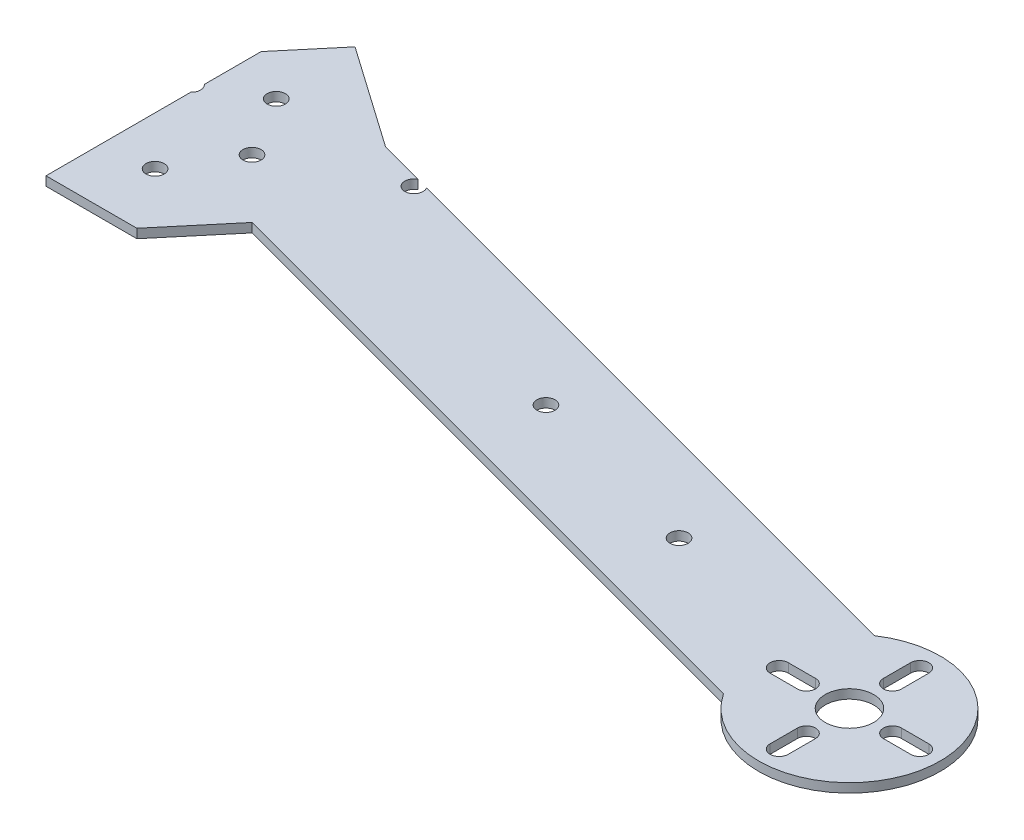
from build123d import *

# Parameters (mm, degrees)
SKETCH2_R           = 1.5
SKETCH2_R_2         = 4
BOSS_EXTRUDE1_DEPTH = 1.5
SKETCH6_R           = 1.5
CUT_EXTRUDE1_DEPTH  = 1.5
SKETCH7_R           = 1.5
CUT_EXTRUDE2_DEPTH  = 1.5


with BuildPart() as part:
    # Sketch2 → Boss-Extrude1 (new body)
    with BuildSketch(Plane(origin=(0, 0, 0), x_dir=(1, 0, 0), z_dir=(0, 1, 0))):
        with BuildLine():
            Line((0, -46.879161521), (0, -70.761127532))
            Line((0, -70.761127532), (15, -70.761127532))
            Line((15, -70.761127532), (23.677632731, -60.41952755))
            Line((23.677632731, -60.41952755), (129.929473623, -88.889622511))
            ThreePointArc((129.929473623, -88.889622511), (157.136079306, -83.55030532), (134.097880355, -68.124706791))
            Line((134.097880355, -68.124706791), (23.863280614, -38.592955603))
            Line((23.863280614, -38.592955603), (7.070663707, -26.834638658))
            Line((7.070663707, -26.834638658), (0, -35.261127532))
            Line((0, -35.261127532), (0, -44.643093543))
            ThreePointArc((0, -44.643093543), (0.5, -45.761127532), (0, -46.879161521))
        make_face()
        with Locations(Location((8, -40.761127532, 0), (0, 0, 90))):
            Circle(SKETCH2_R, mode=Mode.SUBTRACT)
        with Locations(Location((14, -50.761127532, 0), (0, 0, 90))):
            Circle(SKETCH2_R, mode=Mode.SUBTRACT)
        with Locations(Location((8, -60.761127532, 0), (0, 0, 90))):
            Circle(SKETCH2_R, mode=Mode.SUBTRACT)
        with Locations(Location((142.429473623, -80.598060535, 0), (0, 0, 90))):
            Circle(SKETCH2_R_2, mode=Mode.SUBTRACT)
        with BuildLine():
            Line((143.929473623, -73.498060535), (143.929473623, -68.998060535))
            ThreePointArc((143.929473623, -68.998060535), (142.429473623, -67.498060535), (140.929473623, -68.998060535))
            Line((140.929473623, -68.998060535), (140.929473623, -73.498060535))
            ThreePointArc((140.929473623, -73.498060535), (142.429473623, -74.998060535), (143.929473623, -73.498060535))
        make_face(mode=Mode.SUBTRACT)
        with BuildLine():
            Line((149.529473623, -82.098060535), (154.029473623, -82.098060535))
            ThreePointArc((154.029473623, -82.098060535), (155.529473623, -80.598060535), (154.029473623, -79.098060535))
            Line((154.029473623, -79.098060535), (149.529473623, -79.098060535))
            ThreePointArc((149.529473623, -79.098060535), (148.029473623, -80.598060535), (149.529473623, -82.098060535))
        make_face(mode=Mode.SUBTRACT)
        with BuildLine():
            Line((140.929473623, -87.698060535), (140.929473623, -92.198060535))
            ThreePointArc((140.929473623, -92.198060535), (142.429473623, -93.698060535), (143.929473623, -92.198060535))
            Line((143.929473623, -92.198060535), (143.929473623, -87.698060535))
            ThreePointArc((143.929473623, -87.698060535), (142.429473623, -86.198060535), (140.929473623, -87.698060535))
        make_face(mode=Mode.SUBTRACT)
        with BuildLine():
            Line((135.329473623, -79.098060535), (130.829473623, -79.098060535))
            ThreePointArc((130.829473623, -79.098060535), (129.329473623, -80.598060535), (130.829473623, -82.098060535))
            Line((130.829473623, -82.098060535), (135.329473623, -82.098060535))
            ThreePointArc((135.329473623, -82.098060535), (136.829473623, -80.598060535), (135.329473623, -79.098060535))
        make_face(mode=Mode.SUBTRACT)
    extrude(amount=BOSS_EXTRUDE1_DEPTH)

    # Sketch6 → Cut-Extrude1 (cut)
    with BuildSketch(Plane(origin=(0, 1.5, 0), x_dir=(1, 0, 0), z_dir=(0, 1, 0))):
        with Locations((31.86, -41.901127532)):
            Circle(SKETCH6_R)
    extrude(amount=-CUT_EXTRUDE1_DEPTH, mode=Mode.SUBTRACT)

    # Sketch7 → Cut-Extrude2 (cut)
    with BuildSketch(Plane(origin=(0, 1.5, 0), x_dir=(1, 0, 0), z_dir=(0, 1, 0))):
        with Locations(Location((74.014122572, -62.269648862, 0), (0, 0, 270))):
            Circle(SKETCH7_R)
        with Locations(Location((104.014122572, -70.306622169, 0), (0, 0, 270))):
            Circle(SKETCH7_R)
    extrude(amount=-CUT_EXTRUDE2_DEPTH, mode=Mode.SUBTRACT)


solid = part.part
